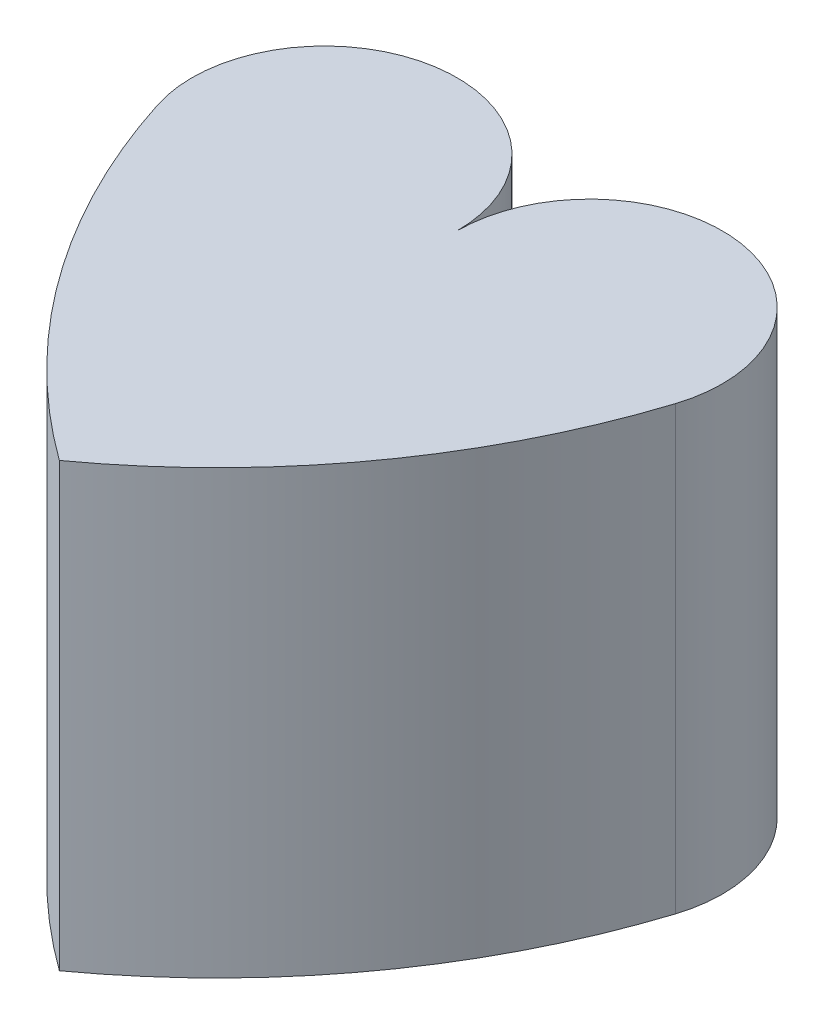
from build123d import *

# Parameters (mm, degrees)
BOSS_EXTRUDE1_DEPTH = 2.5


with BuildPart() as part:
    # Sketch1 → Boss-Extrude1 (new, symmetric)
    with BuildSketch(Plane(origin=(0, 0, 0), x_dir=(1, 0, 0), z_dir=(0, 1, 0))):
        with BuildLine():
            ThreePointArc((2.928688921, 1.043001129), (1.731264588, 2.982065009), (0, 1.5))
            ThreePointArc((0, 1.5), (-1.731264588, 2.982065009), (-2.928688921, 1.043001129))
            ThreePointArc((-2.928688921, 1.043001129), (-1.787791512, -1.212799592), (0, -3))
            ThreePointArc((0, -3), (1.787791512, -1.212799592), (2.928688921, 1.043001129))
        make_face()
    extrude(amount=BOSS_EXTRUDE1_DEPTH, both=True)


solid = part.part
